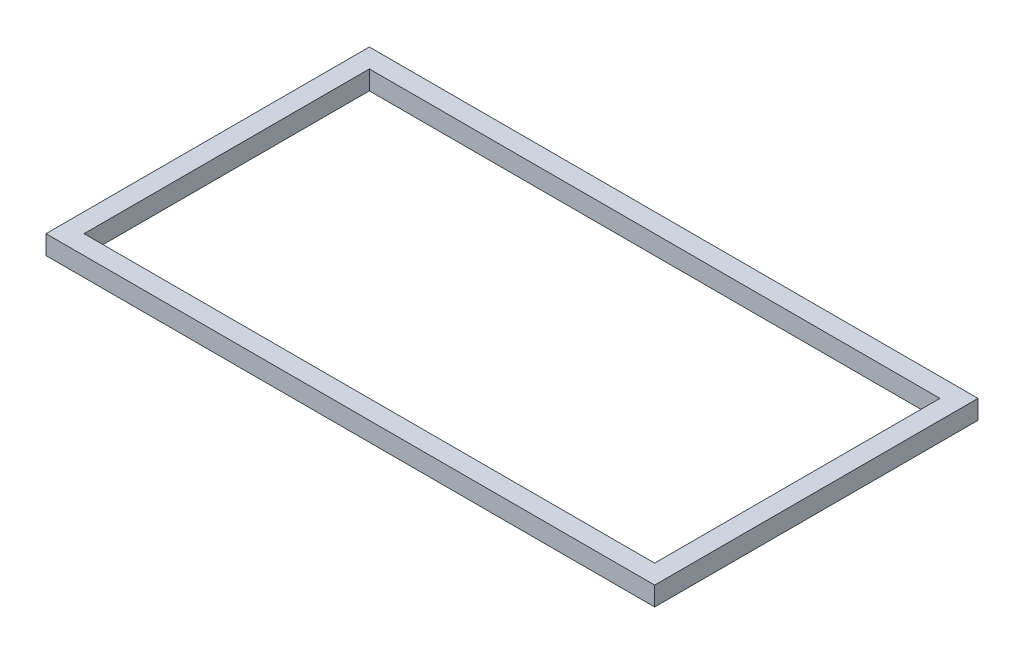
from build123d import *

# Parameters (mm, degrees)
SKETCH1_W           = 812.8
SKETCH1_H           = 431.8
BOSS_EXTRUDE1_DEPTH = 25.4
SKETCH2_W           = 762
SKETCH2_H           = 381
CUT_EXTRUDE1_DEPTH  = 921.728103188


with BuildPart() as part:
    # Sketch1 → Boss-Extrude1 (new body)
    with BuildSketch(Plane(origin=(0, 0, 0), x_dir=(1, 0, 0), z_dir=(0, 1, 0))):
        with Locations((406.4, 215.9)):
            Rectangle(SKETCH1_W, SKETCH1_H)
    extrude(amount=BOSS_EXTRUDE1_DEPTH)

    # Sketch2 → Cut-Extrude1 (cut, through all)
    with BuildSketch(Plane(origin=(0, 25.4, 0), x_dir=(1, 0, 0), z_dir=(0, 1, 0))):
        with Locations((406.4, 215.9)):
            Rectangle(SKETCH2_W, SKETCH2_H)
    extrude(amount=-CUT_EXTRUDE1_DEPTH, mode=Mode.SUBTRACT)


solid = part.part
